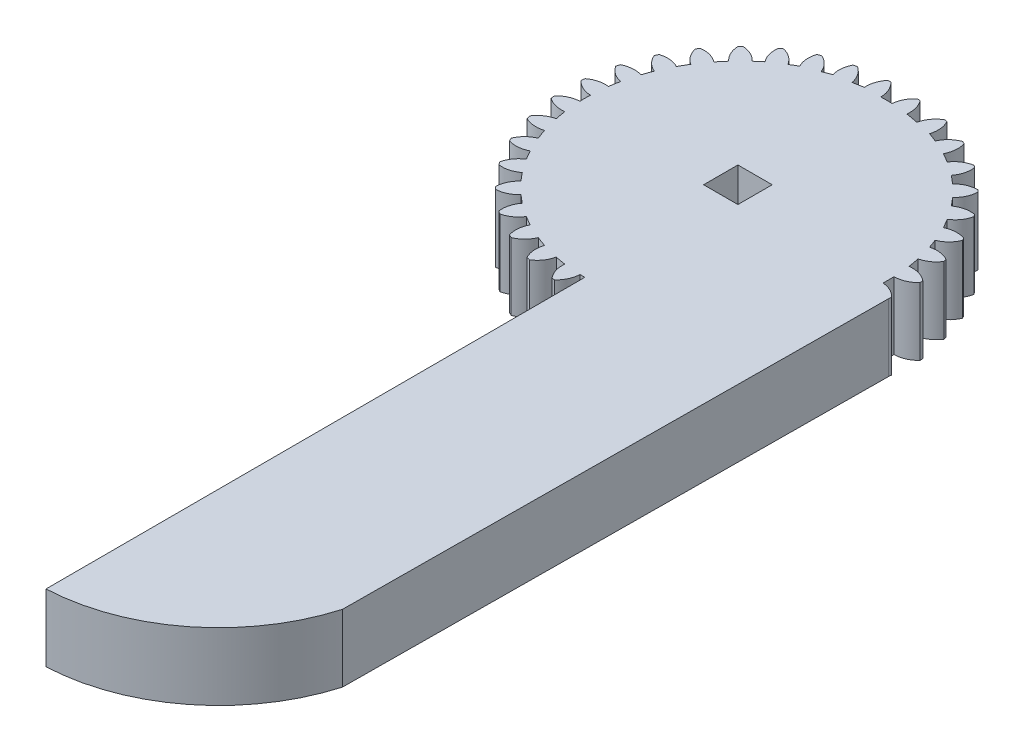
from build123d import *

# Parameters (mm, degrees)
SKETCH1_W           = 3.23
SKETCH1_H           = 3.23
BOSS_EXTRUDE1_DEPTH = 6.35
BOSS_EXTRUDE2_START = -6.35
BOSS_EXTRUDE2_DEPTH = 6.35


with BuildPart() as part:
    # Sketch1 → Boss-Extrude1 (new body)
    with BuildSketch(Plane(origin=(0, 0, 0), x_dir=(1, 0, 0), z_dir=(0, 1, 0))):
        with BuildLine():
            ThreePointArc((-8.462855514, 9.047876504), (-8.640944231, 8.583939533), (-8.802733295, 8.114069974))
            ThreePointArc((-8.802733295, 8.114069974), (-9.714772651, 8.220607066), (-10.597388818, 7.967319405))
            ThreePointArc((-10.597388818, 7.967319405), (-10.643217307, 7.799941065), (-10.687217841, 7.632072926))
            ThreePointArc((-10.687217841, 7.632072926), (-10.049493649, 6.971411294), (-9.206375852, 6.607655445))
            ThreePointArc((-9.206375852, 6.607655445), (-9.301197192, 6.119841938), (-9.378936324, 5.629016377))
            ThreePointArc((-9.378936324, 5.629016377), (-10.295619724, 5.575560959), (-11.120844028, 5.172856618))
            ThreePointArc((-11.120844028, 5.172856618), (-11.136911336, 5.000063097), (-11.151093406, 4.82710464))
            ThreePointArc((-11.151093406, 4.82710464), (-10.408334989, 4.287219586), (-9.514860505, 4.075395875))
            ThreePointArc((-9.514860505, 4.075395875), (-9.52353337, 3.578527798), (-9.514860505, 3.081659722))
            ThreePointArc((-9.514860505, 3.081659722), (-10.408334989, 2.86983601), (-11.151093406, 2.329950956))
            ThreePointArc((-11.151093406, 2.329950956), (-11.136911336, 2.156992499), (-11.120844028, 1.984198979))
            ThreePointArc((-11.120844028, 1.984198979), (-10.295619724, 1.581494637), (-9.378936324, 1.52803922))
            ThreePointArc((-9.378936324, 1.52803922), (-9.301197192, 1.037213659), (-9.206375852, 0.549400152))
            ThreePointArc((-9.206375852, 0.549400152), (-10.049493649, 0.185644303), (-10.687217841, -0.47501733))
            ThreePointArc((-10.687217841, -0.47501733), (-10.643217307, -0.642885469), (-10.597388818, -0.810263808))
            ThreePointArc((-10.597388818, -0.810263808), (-9.714772651, -1.06355147), (-8.802733295, -0.957014377))
            ThreePointArc((-8.802733295, -0.957014377), (-8.640944231, -1.426883937), (-8.462855514, -1.890820907))
            ThreePointArc((-8.462855514, -1.890820907), (-9.229998917, -2.395456357), (-9.743311957, -3.156820699))
            ThreePointArc((-9.743311957, -3.156820699), (-9.670829894, -3.314497931), (-9.596632698, -3.471375383))
            ThreePointArc((-9.596632698, -3.471375383), (-8.683442513, -3.567550347), (-7.803759057, -3.30425782))
            ThreePointArc((-7.803759057, -3.30425782), (-7.56283594, -3.738894629), (-7.30689098, -4.164858573))
            ThreePointArc((-7.30689098, -4.164858573), (-7.974750725, -4.795040531), (-8.348055856, -5.633973911))
            ThreePointArc((-8.348055856, -5.633973911), (-8.249294594, -5.776669294), (-8.148983137, -5.918279218))
            ThreePointArc((-8.148983137, -5.918279218), (-7.232965756, -5.854419256), (-6.412366935, -5.442371305))
            ThreePointArc((-6.412366935, -5.442371305), (-6.099630092, -5.828569144), (-5.773605649, -6.203617363))
            ThreePointArc((-5.773605649, -6.203617363), (-6.321889155, -6.940198068), (-6.54384369, -7.831209921))
            ThreePointArc((-6.54384369, -7.831209921), (-6.42180404, -7.954587727), (-6.298426234, -8.076627377))
            ThreePointArc((-6.298426234, -8.076627377), (-5.407414381, -7.854672842), (-4.670833676, -7.306389336))
            ThreePointArc((-4.670833676, -7.306389336), (-4.295785457, -7.632413779), (-3.909587618, -7.945150622))
            ThreePointArc((-3.909587618, -7.945150622), (-4.321635569, -8.765749443), (-4.385495531, -9.681766824))
            ThreePointArc((-4.385495531, -9.681766824), (-4.243885607, -9.782078281), (-4.101190224, -9.880839543))
            ThreePointArc((-4.101190224, -9.880839543), (-3.262256844, -9.507534412), (-2.632074886, -8.839674667))
            ThreePointArc((-2.632074886, -8.839674667), (-2.206110942, -9.095619627), (-1.771474133, -9.336542744))
            ThreePointArc((-1.771474133, -9.336542744), (-2.03476666, -10.2162262), (-1.938591696, -11.129416385))
            ThreePointArc((-1.938591696, -11.129416385), (-1.781714244, -11.203613581), (-1.624037012, -11.276095644))
            ThreePointArc((-1.624037012, -11.276095644), (-0.86267267, -10.762782604), (-0.35803722, -9.995639201))
            ThreePointArc((-0.35803722, -9.995639201), (0.10589975, -10.173727918), (0.57576931, -10.335516982))
            ThreePointArc((0.57576931, -10.335516982), (0.469232217, -11.247556338), (0.722519879, -12.130172505))
            ThreePointArc((0.722519879, -12.130172505), (0.889898218, -12.176000994), (1.057766357, -12.220001528))
            ThreePointArc((1.057766357, -12.220001528), (1.71842799, -11.582277336), (2.082183839, -10.739159539))
            ThreePointArc((2.082183839, -10.739159539), (2.569997346, -10.833980879), (3.060822907, -10.911720011))
            ThreePointArc((3.060822907, -10.911720011), (3.149666484, -11.836587815), (3.59206838, -12.653627715))
            ThreePointArc((3.59206838, -12.653627715), (3.730358847, -12.666334823), (3.868754937, -12.677834652))
            ThreePointArc((3.868754937, -12.677834652), (4.408134538, -11.936175695), (4.620377987, -11.044020394))
            ThreePointArc((4.620377987, -11.044020394), (5.079808438, -11.05022529), (5.539199857, -11.041601751))
            ThreePointArc((5.539199857, -11.041601751), (5.785299755, -11.944223743), (6.365908621, -12.677834652))
            ThreePointArc((6.365908621, -12.677834652), (6.504304711, -12.666334823), (6.642595178, -12.653627715))
            ThreePointArc((6.642595178, -12.653627715), (7.045299519, -11.828403411), (7.098754937, -10.911720011))
            ThreePointArc((7.098754937, -10.911720011), (7.552431399, -10.839251773), (8.00353342, -10.752183153))
            ThreePointArc((8.00353342, -10.752183153), (8.400404324, -11.594659301), (9.094917805, -12.215081414))
            ThreePointArc((9.094917805, -12.215081414), (9.229214423, -12.179724065), (9.36319738, -12.143196119))
            ThreePointArc((9.36319738, -12.143196119), (9.616485042, -11.260579951), (9.509947949, -10.348540596))
            ThreePointArc((9.509947949, -10.348540596), (9.944148069, -10.198393222), (10.37327753, -10.034314326))
            ThreePointArc((10.37327753, -10.034314326), (10.910522669, -10.802153883), (11.706354917, -11.296988157))
            ThreePointArc((11.706354917, -11.296988157), (11.832471528, -11.238847603), (11.958075972, -11.179608701))
            ThreePointArc((11.958075972, -11.179608701), (12.054967943, -10.274253524), (11.79829892, -9.400653466))
            ThreePointArc((11.79829892, -9.400653466), (12.176126168, -9.190069757), (12.547381861, -8.968105486))
            ThreePointArc((12.547381861, -8.968105486), (13.211132103, -9.637819078), (14.085606134, -9.990488678))
            ThreePointArc((14.085606134, -9.990488678), (14.19971075, -9.91133149), (14.313120252, -9.831181577))
            ThreePointArc((14.313120252, -9.831181577), (14.252521004, -8.927188463), (13.852447813, -8.114281788))
            ThreePointArc((13.852447813, -8.114281788), (14.194403656, -7.836076189), (14.527582382, -7.547417065))
            ThreePointArc((14.527582382, -7.547417065), (15.301215118, -8.102845792), (16.232262195, -8.303245449))
            ThreePointArc((16.232262195, -8.303245449), (16.330887803, -8.205476777), (16.428656475, -8.106851169))
            ThreePointArc((16.428656475, -8.106851169), (16.216578912, -7.236982951), (15.692789507, -6.510834023))
            ThreePointArc((15.692789507, -6.510834023), (15.982509106, -6.176401874), (16.261696278, -5.833128176))
            ThreePointArc((16.261696278, -5.833128176), (17.124338923, -6.253002793), (18.082999811, -6.290636911))
            ThreePointArc((18.082999811, -6.290636911), (18.163149724, -6.177227408), (18.242306912, -6.063122792))
            ThreePointArc((18.242306912, -6.063122792), (17.882789494, -5.243857914), (17.241617428, -4.619881875))
            ThreePointArc((17.241617428, -4.619881875), (17.474897358, -4.230268515), (17.695632944, -3.833413507))
            ThreePointArc((17.695632944, -3.833413507), (18.61831938, -4.098559357), (19.569716056, -3.970118913))
            ThreePointArc((19.569716056, -3.970118913), (19.628954958, -3.844514469), (19.687095512, -3.718397858))
            ThreePointArc((19.687095512, -3.718397858), (19.19631359, -2.97961663), (18.465461171, -2.477103606))
            ThreePointArc((18.465461171, -2.477103606), (18.741734831, -2.033474927), (19.001540189, -1.580005285))
            ThreePointArc((19.001540189, -1.580005285), (19.89772097, -1.636217399), (20.748872263, -1.350138262))
            ThreePointArc((20.748872263, -1.350138262), (20.78540021, -1.216155305), (20.820757558, -1.081858686))
            ThreePointArc((20.820757558, -1.081858686), (20.156653709, -0.403213471), (19.27728391, -0.045020775))
            ThreePointArc((19.27728391, -0.045020775), (19.376336607, 0.46102948), (19.456998732, 0.970334809))
            ThreePointArc((19.456998732, 0.970334809), (20.346001849, 1.074264832), (21.130625654, 1.504954367))
            ThreePointArc((21.130625654, 1.504954367), (21.143332763, 1.643244833), (21.154832591, 1.781640923))
            ThreePointArc((21.154832591, 1.781640923), (20.443550835, 2.306780494), (19.588030231, 2.529889889))
            ThreePointArc((19.588030231, 2.529889889), (19.597746812, 3.0471139), (19.588666391, 3.56434947))
            ThreePointArc((19.588666391, 3.56434947), (20.522537639, 3.76234749), (21.299170125, 4.317469733))
            ThreePointArc((21.299170125, 4.317469733), (21.287670296, 4.455865823), (21.274963188, 4.59415629))
            ThreePointArc((21.274963188, 4.59415629), (20.419357302, 5.049313128), (19.452653374, 5.117962197))
            ThreePointArc((19.452653374, 5.117962197), (19.370622286, 5.635446398), (19.269605831, 6.149561825))
            ThreePointArc((19.269605831, 6.149561825), (20.081412655, 6.517046287), (20.69648683, 7.161839981))
            ThreePointArc((20.69648683, 7.161839981), (20.661129481, 7.2961366), (20.624601534, 7.430119557))
            ThreePointArc((20.624601534, 7.430119557), (19.760465898, 7.717316138), (18.852184914, 7.652216751))
            ThreePointArc((18.852184914, 7.652216751), (18.709628751, 8.063938787), (18.55454075, 8.471105837))
            ThreePointArc((18.55454075, 8.471105837), (19.330701101, 8.976064849), (19.849625529, 9.74295854))
            ThreePointArc((19.849625529, 9.74295854), (19.791484974, 9.869075151), (19.732246073, 9.994679595))
            ThreePointArc((19.732246073, 9.994679595), (18.810826262, 10.128345065), (17.910409729, 9.891425265))
            ThreePointArc((17.910409729, 9.891425265), (17.669486611, 10.326062073), (17.413541652, 10.752026018))
            ThreePointArc((17.413541652, 10.752026018), (18.081401397, 11.382207975), (18.454706528, 12.221141355))
            ThreePointArc((18.454706528, 12.221141355), (18.37554934, 12.335245971), (18.295399427, 12.448655474))
            ThreePointArc((18.295399427, 12.448655474), (17.364571587, 12.419809222), (16.519017607, 12.02953875))
            ThreePointArc((16.519017607, 12.02953875), (16.206280764, 12.415736588), (15.880256321, 12.790784807))
            ThreePointArc((15.880256321, 12.790784807), (16.428539827, 13.527365512), (16.650494361, 14.418377365))
            ThreePointArc((16.650494361, 14.418377365), (16.55272569, 14.517002974), (16.454100081, 14.614771645))
            ThreePointArc((16.454100081, 14.614771645), (15.542422707, 14.424727075), (14.777484348, 13.89355678))
            ThreePointArc((14.777484348, 13.89355678), (14.402436129, 14.219581223), (14.01623829, 14.532318066))
            ThreePointArc((14.01623829, 14.532318066), (14.428286241, 15.352916887), (14.492146203, 16.268934268))
            ThreePointArc((14.492146203, 16.268934268), (14.3787367, 16.349084181), (14.264632084, 16.428241369))
            ThreePointArc((14.264632084, 16.428241369), (13.399806031, 16.082772888), (12.738725558, 15.426842112))
            ThreePointArc((12.738725558, 15.426842112), (12.312761614, 15.682787071), (11.878124805, 15.923710188))
            ThreePointArc((11.878124805, 15.923710188), (12.141417332, 16.803393644), (12.045242368, 17.716583829))
            ThreePointArc((12.045242368, 17.716583829), (11.919637925, 17.775822731), (11.793521313, 17.833963285))
            ThreePointArc((11.793521313, 17.833963285), (11.001823883, 17.343567778), (10.464687892, 16.582806645))
            ThreePointArc((10.464687892, 16.582806645), (10.033061187, 16.749091164), (9.596260574, 16.901266652))
            ThreePointArc((9.596260574, 16.901266652), (9.699910901, 17.809551351), (9.446964423, 18.688040146))
            ThreePointArc((9.446964423, 18.688040146), (9.312981465, 18.724568093), (9.178684847, 18.759925442))
            ThreePointArc((9.178684847, 18.759925442), (8.465563131, 18.114397653), (8.073097053, 17.236206849))
            ThreePointArc((8.073097053, 17.236206849), (7.499612403, 17.350517185), (6.921917373, 17.441181119))
            ThreePointArc((6.921917373, 17.441181119), (6.861415117, 18.344183323), (6.462161477, 19.156384058))
            ThreePointArc((6.462161477, 19.156384058), (6.32387101, 19.169091167), (6.18547492, 19.180590995))
            ThreePointArc((6.18547492, 19.180590995), (5.623216459, 18.473815271), (5.371155656, 17.606559915))
            ThreePointArc((5.371155656, 17.606559915), (4.839145498, 17.61677297), (4.30712527, 17.60709863))
            ThreePointArc((4.30712527, 17.60709863), (4.107075289, 18.535308335), (3.554060643, 19.30716846))
            ThreePointArc((3.554060643, 19.30716846), (3.415664553, 19.295668632), (3.277374086, 19.282961523))
            ThreePointArc((3.277374086, 19.282961523), (2.849238831, 18.497821252), (2.74757019, 17.609334601))
            ThreePointArc((2.74757019, 17.609334601), (2.255694411, 17.531746281), (1.766832809, 17.437004192))
            ThreePointArc((1.766832809, 17.437004192), (1.409129974, 18.319199848), (0.729099872, 18.98536766))
            ThreePointArc((0.729099872, 18.98536766), (0.562428356, 18.944675072), (0.39620523, 18.902187976))
            ThreePointArc((0.39620523, 18.902187976), (0.145734514, 18.051347793), (0.230570084, 17.168473213))
            ThreePointArc((0.230570084, 17.168473213), (-0.174823167, 17.022010631), (-0.575596864, 16.863342993))
            ThreePointArc((-0.575596864, 16.863342993), (-1.081016468, 17.662300067), (-1.861750425, 18.195437827))
            ThreePointArc((-1.861750425, 18.195437827), (-2.019646056, 18.125279175), (-2.176770655, 18.053410356))
            ThreePointArc((-2.176770655, 18.053410356), (-2.274784626, 17.160948359), (-2.028863737, 16.29745657))
            ThreePointArc((-2.028863737, 16.29745657), (-2.379157101, 16.096040059), (-2.723593438, 15.88476379))
            ThreePointArc((-2.723593438, 15.88476379), (-3.35698515, 16.567895857), (-4.207004588, 16.949106346))
            ThreePointArc((-4.207004588, 16.949106346), (-4.350472997, 16.850826828), (-4.492858875, 16.750985404))
            ThreePointArc((-4.492858875, 16.750985404), (-4.43008995, 15.838963175), (-4.02203884, 15.020905246))
            ThreePointArc((-4.02203884, 15.020905246), (-4.350623862, 14.747048792), (-4.670833676, 14.463444932))
            ThreePointArc((-4.670833676, 14.463444932), (-5.407414381, 15.011728438), (-6.298426234, 15.233682973))
            ThreePointArc((-6.298426234, 15.233682973), (-6.42180404, 15.111643324), (-6.54384369, 14.988265518))
            ThreePointArc((-6.54384369, 14.988265518), (-6.321889155, 14.097253665), (-5.773605649, 13.36067296))
            ThreePointArc((-5.773605649, 13.36067296), (-6.099630092, 12.985624741), (-6.412366935, 12.599426902))
            ThreePointArc((-6.412366935, 12.599426902), (-7.232965756, 13.011474852), (-8.148983137, 13.075334814))
            ThreePointArc((-8.148983137, 13.075334814), (-8.249294594, 12.93372489), (-8.348055856, 12.791029508))
            ThreePointArc((-8.348055856, 12.791029508), (-7.974750725, 11.952096127), (-7.30689098, 11.32191417))
            ThreePointArc((-7.30689098, 11.32191417), (-7.56283594, 10.895950226), (-7.803759057, 10.461313417))
            ThreePointArc((-7.803759057, 10.461313417), (-8.683442513, 10.724605943), (-9.596632698, 10.62843098))
            ThreePointArc((-9.596632698, 10.62843098), (-9.670829894, 10.471553527), (-9.743311957, 10.313876295))
            ThreePointArc((-9.743311957, 10.313876295), (-9.229998917, 9.552511953), (-8.462855514, 9.047876504))
        make_face()
        with Locations((4.737565748, 3.714560122)):
            Rectangle(SKETCH1_W, SKETCH1_H, mode=Mode.SUBTRACT)
    extrude(amount=BOSS_EXTRUDE1_DEPTH)

    # Sketch3 → Boss-Extrude2 (add)
    with BuildSketch(Plane(origin=(0, 6.35, 0), x_dir=(1, 0, 0), z_dir=(0, 1, 0)).offset(BOSS_EXTRUDE2_START)):
        with BuildLine():
            Line((5.079808438, -11.05022529), (5.12337422, -61.850043953))
            ThreePointArc((5.12337422, -61.850043953), (14.91944054, -58.212338921), (20.748872263, -49.539764964))
            Line((20.748872263, -49.539764964), (21.130625654, 1.504954367))
            ThreePointArc((21.130625654, 1.504954367), (20.346001849, 1.074264832), (19.456998732, 0.970334809))
            ThreePointArc((19.456998732, 0.970334809), (19.376336607, 0.46102948), (19.27728391, -0.045020775))
            ThreePointArc((19.27728391, -0.045020775), (20.156653709, -0.403213471), (20.820757558, -1.081858686))
            ThreePointArc((20.820757558, -1.081858686), (20.78540021, -1.216155305), (20.748872263, -1.350138262))
            ThreePointArc((20.748872263, -1.350138262), (19.89772097, -1.636217399), (19.001540189, -1.580005285))
            ThreePointArc((19.001540189, -1.580005285), (18.741734831, -2.033474927), (18.465461171, -2.477103606))
            ThreePointArc((18.465461171, -2.477103606), (19.19631359, -2.97961663), (19.687095512, -3.718397858))
            ThreePointArc((19.687095512, -3.718397858), (19.628954958, -3.844514469), (19.569716056, -3.970118913))
            ThreePointArc((19.569716056, -3.970118913), (18.61831938, -4.098559357), (17.695632944, -3.833413507))
            ThreePointArc((17.695632944, -3.833413507), (17.474897358, -4.230268515), (17.241617428, -4.619881875))
            ThreePointArc((17.241617428, -4.619881875), (17.882789494, -5.243857914), (18.242306912, -6.063122792))
            ThreePointArc((18.242306912, -6.063122792), (18.163149724, -6.177227408), (18.082999811, -6.290636911))
            ThreePointArc((18.082999811, -6.290636911), (17.124338923, -6.253002793), (16.261696278, -5.833128176))
            ThreePointArc((16.261696278, -5.833128176), (15.982509106, -6.176401874), (15.692789507, -6.510834023))
            ThreePointArc((15.692789507, -6.510834023), (16.216578912, -7.236982951), (16.428656475, -8.106851169))
            ThreePointArc((16.428656475, -8.106851169), (16.330887803, -8.205476777), (16.232262195, -8.303245449))
            ThreePointArc((16.232262195, -8.303245449), (15.301215118, -8.102845792), (14.527582382, -7.547417065))
            ThreePointArc((14.527582382, -7.547417065), (14.194403656, -7.836076189), (13.852447813, -8.114281788))
            ThreePointArc((13.852447813, -8.114281788), (14.252521004, -8.927188463), (14.313120252, -9.831181577))
            ThreePointArc((14.313120252, -9.831181577), (14.19971075, -9.91133149), (14.085606134, -9.990488678))
            ThreePointArc((14.085606134, -9.990488678), (13.211132103, -9.637819078), (12.547381861, -8.968105486))
            ThreePointArc((12.547381861, -8.968105486), (12.176126168, -9.190069757), (11.79829892, -9.400653466))
            ThreePointArc((11.79829892, -9.400653466), (12.054967943, -10.274253524), (11.958075972, -11.179608701))
            ThreePointArc((11.958075972, -11.179608701), (11.832471528, -11.238847603), (11.706354917, -11.296988157))
            ThreePointArc((11.706354917, -11.296988157), (10.910522669, -10.802153883), (10.37327753, -10.034314326))
            ThreePointArc((10.37327753, -10.034314326), (9.944148069, -10.198393222), (9.509947949, -10.348540596))
            ThreePointArc((9.509947949, -10.348540596), (9.616485042, -11.260579951), (9.36319738, -12.143196119))
            ThreePointArc((9.36319738, -12.143196119), (9.229214423, -12.179724065), (9.094917805, -12.215081414))
            ThreePointArc((9.094917805, -12.215081414), (8.400404324, -11.594659301), (8.00353342, -10.752183153))
            ThreePointArc((8.00353342, -10.752183153), (7.552431399, -10.839251773), (7.098754937, -10.911720011))
            ThreePointArc((7.098754937, -10.911720011), (7.045299519, -11.828403411), (6.642595178, -12.653627715))
            ThreePointArc((6.642595178, -12.653627715), (6.504304711, -12.666334823), (6.365908621, -12.677834652))
            ThreePointArc((6.365908621, -12.677834652), (5.785299755, -11.944223743), (5.539199857, -11.041601751))
            ThreePointArc((5.539199857, -11.041601751), (5.309538938, -11.047766875), (5.079808438, -11.05022529))
        make_face()
    extrude(amount=BOSS_EXTRUDE2_DEPTH)


solid = part.part
